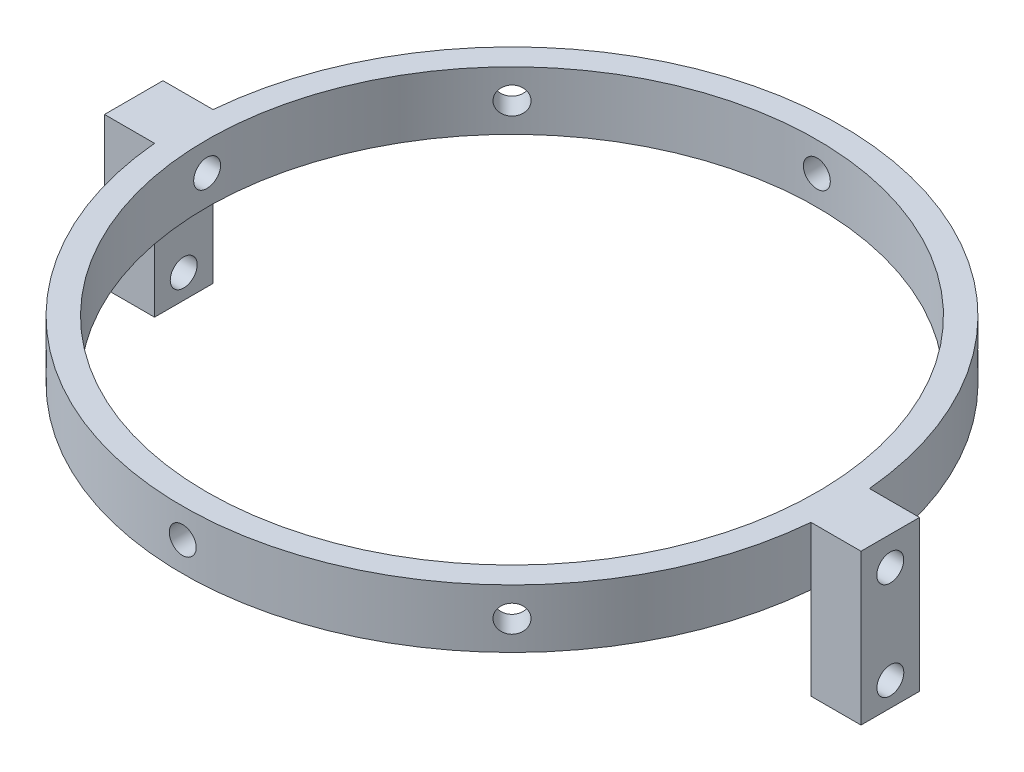
from build123d import *

# Parameters (mm, degrees)
SKETCH1_R           = 42.926
SKETCH1_R_2         = 39.751
BOSS_EXTRUDE1_DEPTH = 7.62
SKETCH2_R           = 1.7526
CUT_EXTRUDE1_DEPTH  = 95.7
CIRPATTERN1_COUNT   = 8
SKETCH6_R           = 1.7526
CUT_EXTRUDE2_DEPTH  = 119.35
BOSS_EXTRUDE2_START = -7.62
SKETCH8_W           = 6.519417161
SKETCH8_H           = 7.62
BOSS_EXTRUDE2_DEPTH = 12
SKETCH10_R          = 1.7526
CUT_EXTRUDE3_DEPTH  = 9
CIRPATTERN2_COUNT   = 2


with BuildPart() as part:
    # Sketch1 → Boss-Extrude1 (new body)
    # profile 1 of 3: a face of its own
    with BuildSketch(Plane(origin=(0, 0, 0), x_dir=(1, 0, 0), z_dir=(0, 1, 0))):
        with BuildLine():
            Line((-167.759899912, -119.886046801), (-167.759899912, -127.506046801))
            Line((-167.759899912, -127.506046801), (-161.24048275, -127.506046801))
            ThreePointArc((-161.24048275, -127.506046801), (-161.409899912, -123.696046801), (-161.24048275, -119.886046801))
            Line((-161.24048275, -119.886046801), (-167.759899912, -119.886046801))
        make_face()
    # profile 2 of 3: a face of its own
    with BuildSketch(Plane(origin=(0, 0, 0), x_dir=(1, 0, 0), z_dir=(0, 1, 0))):
        with Locations((-118.483899912, -123.696046801)):
            Circle(SKETCH1_R)
        with Locations(Location((-118.483899912, -123.696046801, 0), (0, 0, 90))):
            Circle(SKETCH1_R_2, mode=Mode.SUBTRACT)
    # profile 3 of 3: a face of its own
    with BuildSketch(Plane(origin=(0, 0, 0), x_dir=(1, 0, 0), z_dir=(0, 1, 0))):
        with BuildLine():
            ThreePointArc((-75.557899912, -123.696046801), (-75.600275118, -125.602929216), (-75.727317073, -127.506046801))
            Line((-75.727317073, -127.506046801), (-69.207899912, -127.506046801))
            Line((-69.207899912, -127.506046801), (-69.207899912, -119.886046801))
            Line((-69.207899912, -119.886046801), (-75.727317073, -119.886046801))
            ThreePointArc((-75.727317073, -119.886046801), (-75.600275118, -121.789164387), (-75.557899912, -123.696046801))
        make_face()
    extrude(amount=BOSS_EXTRUDE1_DEPTH)

    # Sketch2 → Cut-Extrude1 (cut)
    with BuildSketch(Plane.XY):
        with Locations(Location((-118.483899912, 3.81, 0), (0, 0, 180))):
            Circle(SKETCH2_R)
    cut_extrude1 = extrude(amount=CUT_EXTRUDE1_DEPTH, mode=Mode.SUBTRACT)

    # CirPattern1: Cut-Extrude1 ×8 about axis, 2 skipped
    cirpattern1_axis = Axis((-118.483899912, 7.62, 123.696046801), (0, 1, 0))
    add([cut_extrude1.rotate(cirpattern1_axis, i * 360 / CIRPATTERN1_COUNT) for i in range(1, CIRPATTERN1_COUNT) if i not in (2, 6)], mode=Mode.SUBTRACT)

    # Sketch6 → Cut-Extrude2 (cut)
    with BuildSketch(Plane.ZY.offset(167.759899912)):
        with Locations((123.696046801, 3.877276016)):
            Circle(SKETCH6_R)
    extrude(amount=-CUT_EXTRUDE2_DEPTH, mode=Mode.SUBTRACT)

    # Sketch8 → Boss-Extrude2 (add)
    with BuildSketch(Plane(origin=(0, 7.62, 0), x_dir=(1, 0, 0), z_dir=(0, 1, 0)).offset(BOSS_EXTRUDE2_START)):
        with Locations((-72.467608493, -123.696046801)):
            Rectangle(SKETCH8_W, SKETCH8_H)
    boss_extrude2 = extrude(amount=-BOSS_EXTRUDE2_DEPTH)

    # Sketch10 → Cut-Extrude3 (cut)
    with BuildSketch(Plane(origin=(-69.207899912, 0, 0), x_dir=(0, 0, -1), z_dir=(1, 0, 0))):
        with Locations((-123.683858545, -8.849612584)):
            Circle(SKETCH10_R)
    cut_extrude3 = extrude(amount=-CUT_EXTRUDE3_DEPTH, mode=Mode.SUBTRACT)

    # CirPattern2: Boss-Extrude2, Cut-Extrude3 ×2 about axis
    cirpattern2_axis = Axis((-118.483899912, 7.62, 123.696046801), (0, 1, 0))
    add([boss_extrude2.rotate(cirpattern2_axis, i * 360 / CIRPATTERN2_COUNT) for i in range(1, CIRPATTERN2_COUNT)])
    add([cut_extrude3.rotate(cirpattern2_axis, i * 360 / CIRPATTERN2_COUNT) for i in range(1, CIRPATTERN2_COUNT)], mode=Mode.SUBTRACT)


solid = part.part
